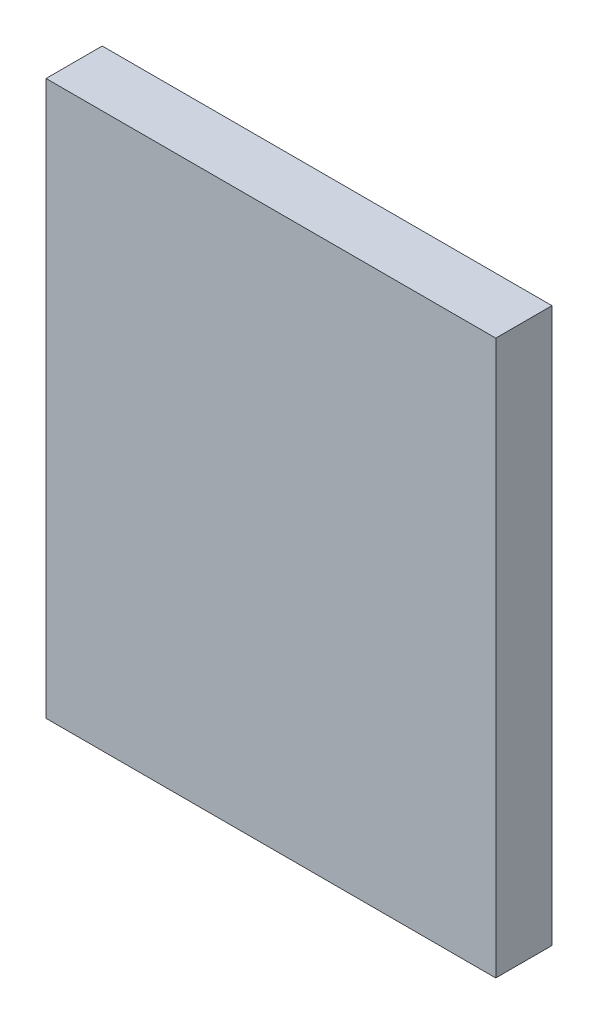
from build123d import *

# Parameters (mm, degrees)
SKETCH2_W           = 25.4
SKETCH2_H           = 31.298227465
BOSS_EXTRUDE1_DEPTH = 3.175


with BuildPart() as part:
    # Sketch2 → Boss-Extrude1 (new body)
    with BuildSketch(Plane.XY):
        with Locations((-4.7625, -39.1615359)):
            Rectangle(SKETCH2_W, SKETCH2_H)
    extrude(amount=BOSS_EXTRUDE1_DEPTH)


solid = part.part
